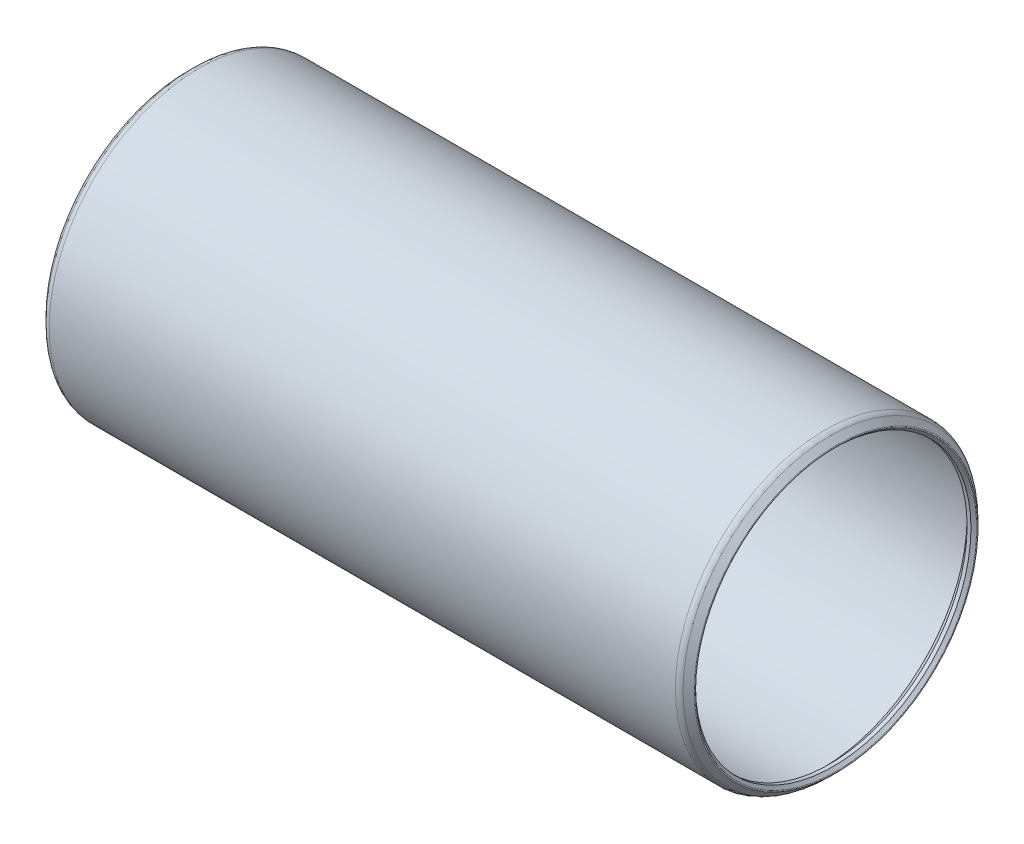
from build123d import *


with BuildPart() as part:
    # Sketch1 → Revolve1 (revolve)
    with BuildSketch(Plane.XY):
        with BuildLine():
            Line((-0.882617928, 18.554667928), (-0.508, 18.18005))
            Line((-0.508, 18.18005), (0, 18.18005))
            Line((0, 18.18005), (1.016, 19.19605))
            Line((1.016, 19.19605), (82.7913, 19.19605))
            Line((82.7913, 19.19605), (83.8073, 18.18005))
            Line((83.8073, 18.18005), (84.3153, 18.18005))
            Line((84.3153, 18.18005), (84.689917928, 18.554667928))
            ThreePointArc((84.689917928, 18.554667928), (84.727115367, 18.64447049), (84.689917928, 18.734273051))
            Line((84.689917928, 18.734273051), (83.95422049, 19.46997049))
            ThreePointArc((83.95422049, 19.46997049), (83.624606367, 19.690211605), (83.2358, 19.76755))
            Line((83.2358, 19.76755), (0.5715, 19.76755))
            ThreePointArc((0.5715, 19.76755), (0.182693633, 19.690211605), (-0.14692049, 19.46997049))
            Line((-0.14692049, 19.46997049), (-0.882617928, 18.734273051))
            ThreePointArc((-0.882617928, 18.734273051), (-0.919815367, 18.64447049), (-0.882617928, 18.554667928))
        make_face()
    revolve(axis=Axis((83.8073, 0, 0), (-1, 0, 0)))


solid = part.part
